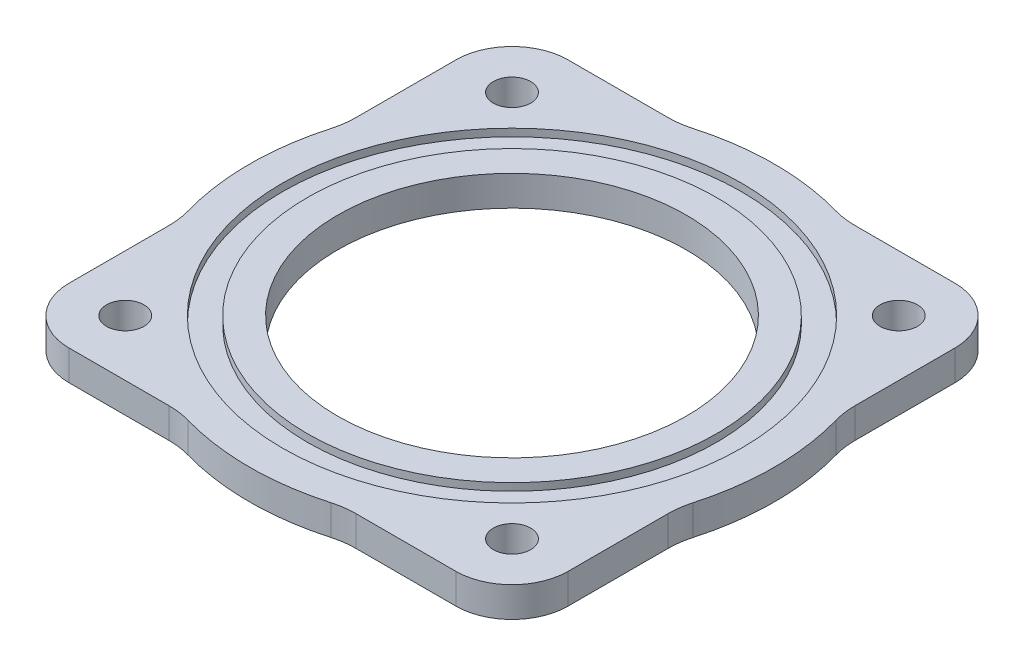
from build123d import *

# Parameters (mm, degrees)
SKETCH1_R           = 22.1742
SKETCH1_R_2         = 2.38125
BOSS_EXTRUDE1_DEPTH = 3.8354
SKETCH2_R           = 29.21
SKETCH2_R_2         = 26.035
CUT_EXTRUDE1_DEPTH  = 0.9525


with BuildPart() as part:
    # Sketch1 → Boss-Extrude1 (new body)
    with BuildSketch(Plane(origin=(0, 0, 0), x_dir=(1, 0, 0), z_dir=(0, 1, 0))):
        with BuildLine():
            Line((0, 43.62908334), (0, 56.35625))
            ThreePointArc((0, 56.35625), (2.092355932, 61.407644068), (7.14375, 63.5))
            Line((7.14375, 63.5), (19.87091666, 63.5))
            ThreePointArc((19.87091666, 63.5), (21.269548228, 63.596728676), (22.641548343, 63.885072886))
            ThreePointArc((22.641548343, 63.885072886), (31.75, 65.151), (40.858451657, 63.885072886))
            ThreePointArc((40.858451657, 63.885072886), (42.230451772, 63.596728676), (43.62908334, 63.5))
            Line((43.62908334, 63.5), (56.35625, 63.5))
            ThreePointArc((56.35625, 63.5), (61.407644068, 61.407644068), (63.5, 56.35625))
            Line((63.5, 56.35625), (63.5, 43.62908334))
            ThreePointArc((63.5, 43.62908334), (63.596728676, 42.230451772), (63.885072886, 40.858451657))
            ThreePointArc((63.885072886, 40.858451657), (65.151, 31.75), (63.885072886, 22.641548343))
            ThreePointArc((63.885072886, 22.641548343), (63.596728676, 21.269548228), (63.5, 19.87091666))
            Line((63.5, 19.87091666), (63.5, 7.14375))
            ThreePointArc((63.5, 7.14375), (61.407644068, 2.092355932), (56.35625, 0))
            Line((56.35625, 0), (43.62908334, 0))
            ThreePointArc((43.62908334, 0), (42.230451772, -0.096728676), (40.858451657, -0.385072886))
            ThreePointArc((40.858451657, -0.385072886), (31.75, -1.651), (22.641548343, -0.385072886))
            ThreePointArc((22.641548343, -0.385072886), (21.269548228, -0.096728676), (19.87091666, 0))
            Line((19.87091666, 0), (7.14375, 0))
            ThreePointArc((7.14375, 0), (2.092355932, 2.092355932), (0, 7.14375))
            Line((0, 7.14375), (0, 19.87091666))
            ThreePointArc((0, 19.87091666), (-0.096728676, 21.269548228), (-0.385072886, 22.641548343))
            ThreePointArc((-0.385072886, 22.641548343), (-1.651, 31.75), (-0.385072886, 40.858451657))
            ThreePointArc((-0.385072886, 40.858451657), (-0.096728676, 42.230451772), (0, 43.62908334))
        make_face()
        with Locations(Location((31.75, 31.75, 0), (0, 0, 270))):
            Circle(SKETCH1_R, mode=Mode.SUBTRACT)
        with Locations(Location((56.35625, 56.35625, 0), (0, 0, 270))):
            Circle(SKETCH1_R_2, mode=Mode.SUBTRACT)
        with Locations(Location((56.35625, 7.14375, 0), (0, 0, 270))):
            Circle(SKETCH1_R_2, mode=Mode.SUBTRACT)
        with Locations(Location((7.14375, 7.14375, 0), (0, 0, 270))):
            Circle(SKETCH1_R_2, mode=Mode.SUBTRACT)
        with Locations(Location((7.14375, 56.35625, 0), (0, 0, 270))):
            Circle(SKETCH1_R_2, mode=Mode.SUBTRACT)
    extrude(amount=-BOSS_EXTRUDE1_DEPTH)

    # Sketch2 → Cut-Extrude1 (cut)
    with BuildSketch(Plane(origin=(0, 0, 0), x_dir=(1, 0, 0), z_dir=(0, 1, 0))):
        with Locations(Location((31.75, 31.75, 0), (0, 0, 270))):
            Circle(SKETCH2_R)
        with Locations(Location((31.75, 31.75, 0), (0, 0, 270))):
            Circle(SKETCH2_R_2, mode=Mode.SUBTRACT)
    extrude(amount=-CUT_EXTRUDE1_DEPTH, mode=Mode.SUBTRACT)


solid = part.part
